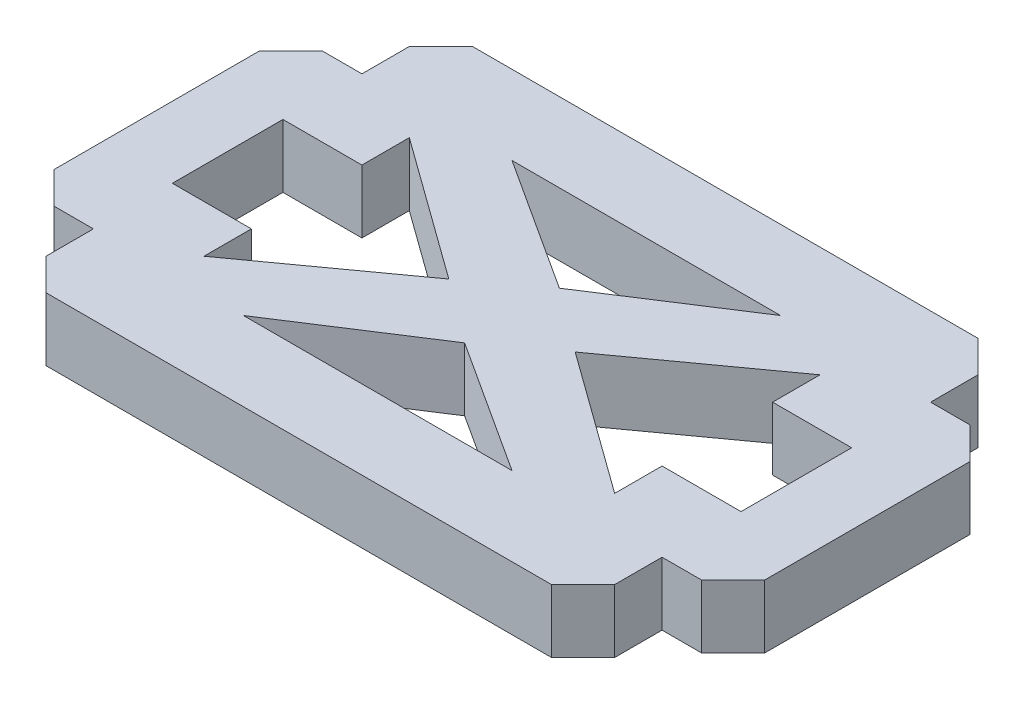
from build123d import *

# Parameters (mm, degrees)
BOSS_EXTRUDE1_DEPTH = 4
CHAMFER1_SIZE       = 2


with BuildPart() as part:
    # Sketch2 → Boss-Extrude1 (new body)
    with BuildSketch(Plane(origin=(0, 0, 0), x_dir=(1, 0, 0), z_dir=(0, 1, 0))):
        Polygon((18, 8.5), (22.5, 8.5), (22.5, -8.5), (18, -8.5), (18, -13.5), (-18, -13.5), (-18, -8.5), (-22.5, -8.5), (-22.5, 8.5), (-18, 8.5), (-18, 13.5), (18, 13.5), align=None)
        Polygon((-8.5, -8.5), (8.5, -8.5), (0, -3), align=None, mode=Mode.SUBTRACT)
        Polygon((-4, 0), (-13, 6.5), (-13, 3.5), (-18, 3.5), (-18, -3.5), (-13, -3.5), (-13, -6.5), align=None, mode=Mode.SUBTRACT)
        Polygon((-8.5, 8.5), (0, 3), (8.5, 8.5), align=None, mode=Mode.SUBTRACT)
        Polygon((4, 0), (13, -6.5), (13, -3.5), (18, -3.5), (18, 3.5), (13, 3.5), (13, 6.5), align=None, mode=Mode.SUBTRACT)
    extrude(amount=BOSS_EXTRUDE1_DEPTH)

    # Chamfer1
    chamfer1_edges = [part.edges().sort_by_distance(p)[0] for p in [
        (22.5, 2, -8.5),
        (22.5, 2, 8.5),
        (18, 2, 13.5),
        (-18, 2, 13.5),
        (-22.5, 2, 8.5),
        (-22.5, 2, -8.5),
        (-18, 2, -13.5),
        (18, 2, -13.5),
    ]]
    chamfer(chamfer1_edges, length=CHAMFER1_SIZE)


solid = part.part
